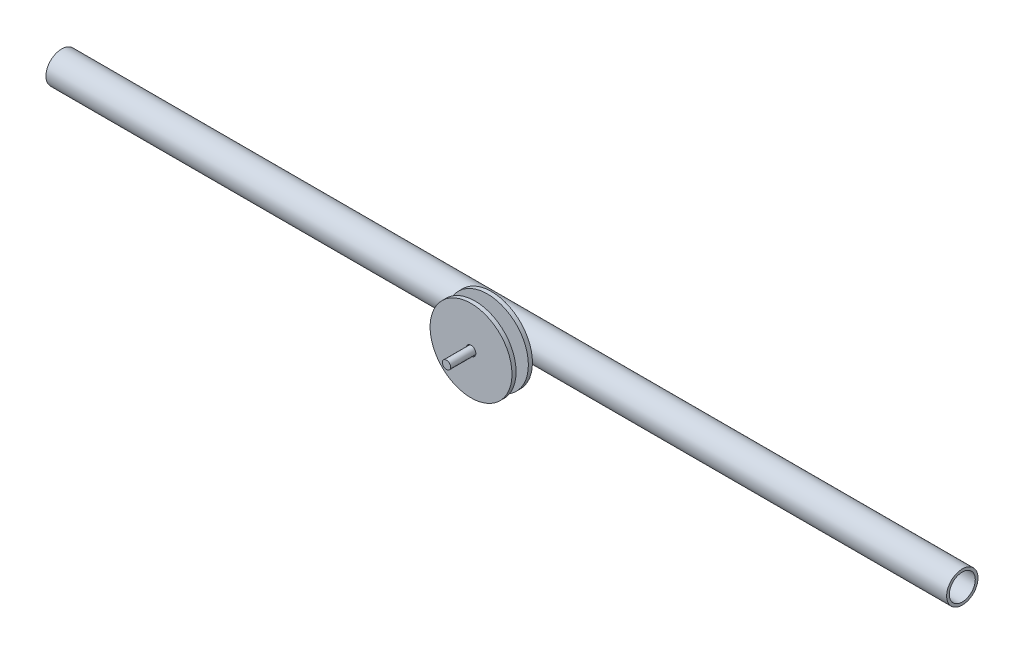
from build123d import *

# Parameters (mm, degrees)
ESQUISSE1_R                = 5.75
ESQUISSE1_R_2              = 4.75
EXTRU_MINCE1_DEPTH         = 165
BOSS_EXTRU_1_START         = -6
ESQUISSE2_R                = 1.5
BOSS_EXTRU_1_DEPTH         = 30
BOSS_EXTRU_2_START         = -9
ESQUISSE3_R                = 15
ESQUISSE3_R_2              = 1.75
BOSS_EXTRU_2_DEPTH         = 1.5
R_P_TITION_LIN_AIRE1_COUNT = 2
R_P_TITION_LIN_AIRE1_PITCH = 6


with BuildPart() as part:
    # Esquisse1 → Extru.-Mince1 (new, symmetric)
    with BuildSketch(Plane(origin=(0, 0, 0), x_dir=(0, 0, -1), z_dir=(1, 0, 0))):
        Circle(ESQUISSE1_R)
        Circle(ESQUISSE1_R_2, mode=Mode.SUBTRACT)
    extrude(amount=EXTRU_MINCE1_DEPTH, both=True)


with BuildPart() as body_2:
    # Esquisse2 → Boss.-Extru.1 (new body)
    with BuildSketch(Plane.XY.offset(BOSS_EXTRU_1_START)):
        Circle(ESQUISSE2_R)
    extrude(amount=BOSS_EXTRU_1_DEPTH)


with BuildPart() as body_3:
    # Esquisse3 → Boss.-Extru.2 (new body)
    with BuildSketch(Plane.XY.offset(24).offset(BOSS_EXTRU_2_START)):
        Circle(ESQUISSE3_R)
        Circle(ESQUISSE3_R_2, mode=Mode.SUBTRACT)
    extrude(amount=-BOSS_EXTRU_2_DEPTH)


with BuildPart() as r_p_tition_lin_aire1_1:
    # Répétition linéaire1: pattern copy
    add(body_3.part.moved(Location(Vector(0, 0, -1) * (1 * R_P_TITION_LIN_AIRE1_PITCH))))


solid = Compound([part.part, body_2.part, body_3.part, r_p_tition_lin_aire1_1.part])
